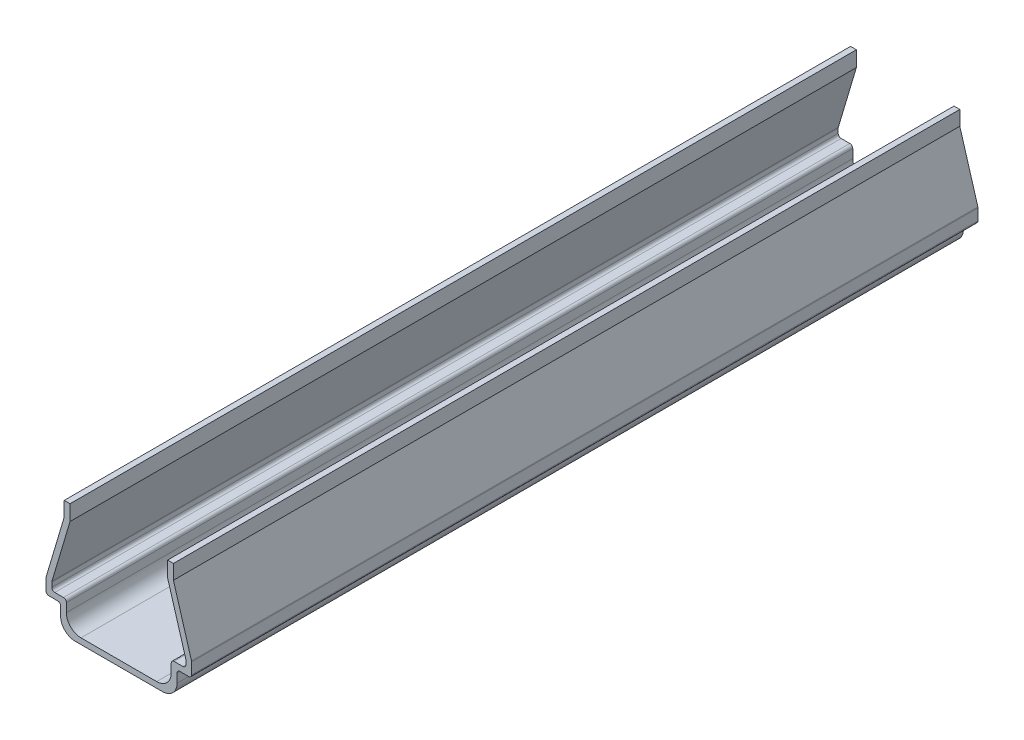
from build123d import *

# Parameters (mm, degrees)
EXTRUDE_THIN1_DEPTH = 54
FILLET1_R           = 1
FILLET2_R           = 0.2


with BuildPart() as part:
    # Sketch1 → Extrude-Thin1 (new body)
    with BuildSketch(Plane.XY):
        Polygon((3.75, 8), (3.75, 7), (5, 2.8), (5, 1.8), (4, 1.8), (4, 0), (-4, 0), (-4, 1.8), (-5, 1.8), (-5, 2.8), (-3.75, 7), (-3.75, 8), (-3.35, 8), (-3.35, 6.941738969), (-4.6, 2.741738969), (-4.6, 2.2), (-3.6, 2.2), (-3.6, 0.4), (3.6, 0.4), (3.6, 2.2), (4.6, 2.2), (4.6, 2.741738969), (3.35, 6.941738969), (3.35, 8), align=None)
    extrude(amount=EXTRUDE_THIN1_DEPTH)

    # Fillet1
    fillet1_edges = [part.edges().sort_by_distance(p)[0] for p in [
        (4, 0, 27),
        (-4, 0, 27),
        (-3.6, 0.4, 27),
        (3.6, 0.4, 27),
    ]]
    fillet(fillet1_edges, radius=FILLET1_R)

    # Fillet2
    fillet2_edges = [part.edges().sort_by_distance(p)[0] for p in [
        (5, 2.8, 27),
        (5, 1.8, 27),
        (4, 1.8, 27),
        (-4, 1.8, 27),
        (-5, 1.8, 27),
        (-5, 2.8, 27),
        (-4.6, 2.741738969, 27),
        (-4.6, 2.2, 27),
        (-3.6, 2.2, 27),
        (3.6, 2.2, 27),
        (4.6, 2.2, 27),
        (4.6, 2.741738969, 27),
    ]]
    fillet(fillet2_edges, radius=FILLET2_R)


solid = part.part
